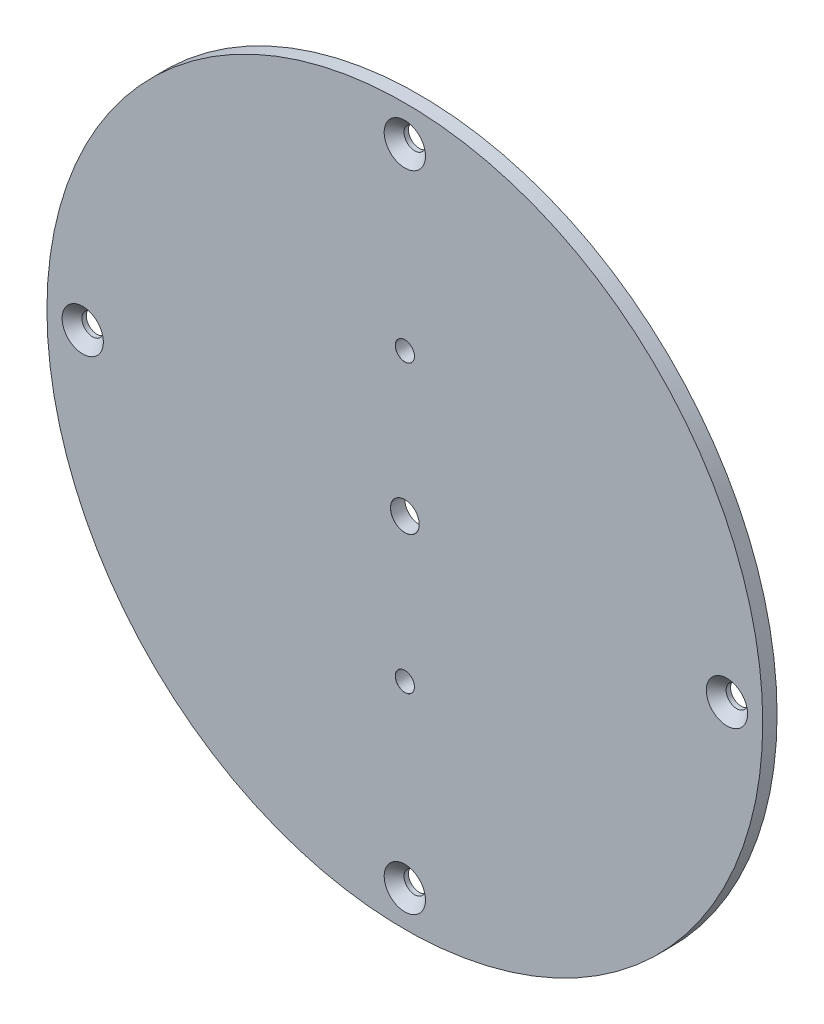
from build123d import *

# Parameters (mm, degrees)
SZKIC1_R                                    = 150
DODANIE_WYCI_GNI_CIE1_DEPTH                 = 6
OTWORY_USTALAJ_CE_8_0MM1_D                  = 8
OTWORY_USTALAJ_CE_8_0MM1_CSINK_D            = 8.05
OTWORY_USTALAJ_CE_8_0MM1_CSINK_ANGLE        = 90
POG_BIENIE_STO_KOWE_POD_M8_WKR_T_DO_2_COUNT = 2
POG_BIENIE_STO_KOWE_POD_M8_WKR_T_DO_2_PITCH = 190.91883092
POG_BIENIE_STO_KOWE_POD_M8_WKR_T_DO_3_COUNT = 2
POG_BIENIE_STO_KOWE_POD_M8_WKR_T_DO_3_PITCH = 270
POG_BIENIE_STO_KOWE_POD_M8_WKR_T_DO_4_COUNT = 2
POG_BIENIE_STO_KOWE_POD_M8_WKR_T_DO_4_PITCH = 190.91883092


with BuildPart() as part:
    # Szkic1 → Dodanie-wyciągnięcie1 (new body)
    with BuildSketch(Plane.XY):
        Circle(SZKIC1_R)
    extrude(amount=DODANIE_WYCI_GNI_CIE1_DEPTH)

    # Otwory ustalające Ø8.0mm1 (through all)
    with Locations(Plane.XY.offset(6)):
        with Locations((0, 60), (0, -60)):
            CounterSinkHole(OTWORY_USTALAJ_CE_8_0MM1_D / 2, OTWORY_USTALAJ_CE_8_0MM1_CSINK_D / 2, counter_sink_angle=OTWORY_USTALAJ_CE_8_0MM1_CSINK_ANGLE)

    # Szkic6 → Otwory ustalające Ø12.0mm1 (revolve, cut)
    with BuildSketch(Plane(origin=(0, 0, 6), x_dir=(0, -1, 0), z_dir=(1, 0, 0))):
        Polygon((0, 0), (0, 6), (6, 6), (6, 0.025), (6.025, 0), align=None)
    revolve(axis=Axis((0, 0, 12.35), (0, 0, -1)), mode=Mode.SUBTRACT)

    # Szkic10 → Pogłębienie stożkowe pod M8 wkręt do części metalowych z łbem soczewkowym1 (revolve, cut)
    with BuildSketch(Plane(origin=(0, 135, 6), x_dir=(0, -1, 0), z_dir=(1, 0, 0))):
        Polygon((0, 0), (0, 6), (4.5, 6), (4.5, 4.15), (8.65, 0), align=None)
    pog_bienie_sto_kowe_pod_m8_wkr_t_do_cz_c = revolve(axis=Axis((0, 135, 12.35), (0, 0, -1)), mode=Mode.SUBTRACT)

    # Pog_bienie sto_kowe pod M8 wkr_t do  2: Pogłębienie stożkowe pod M8 wkręt do części metalowych z łbem soczewkowym1 ×2
    with Locations(*[Vector(0.7071067811865674, -0.7071067811865276, 0) * (i * POG_BIENIE_STO_KOWE_POD_M8_WKR_T_DO_2_PITCH) for i in range(1, POG_BIENIE_STO_KOWE_POD_M8_WKR_T_DO_2_COUNT)]):
        add(pog_bienie_sto_kowe_pod_m8_wkr_t_do_cz_c, mode=Mode.SUBTRACT)

    # Pog_bienie sto_kowe pod M8 wkr_t do  3: Pogłębienie stożkowe pod M8 wkręt do części metalowych z łbem soczewkowym1 ×2
    with Locations(*[(0, -i * POG_BIENIE_STO_KOWE_POD_M8_WKR_T_DO_3_PITCH, 0) for i in range(1, POG_BIENIE_STO_KOWE_POD_M8_WKR_T_DO_3_COUNT)]):
        add(pog_bienie_sto_kowe_pod_m8_wkr_t_do_cz_c, mode=Mode.SUBTRACT)

    # Pog_bienie sto_kowe pod M8 wkr_t do  4: Pogłębienie stożkowe pod M8 wkręt do części metalowych z łbem soczewkowym1 ×2
    with Locations(*[Vector(-0.7071067811865277, -0.7071067811865674, 0) * (i * POG_BIENIE_STO_KOWE_POD_M8_WKR_T_DO_4_PITCH) for i in range(1, POG_BIENIE_STO_KOWE_POD_M8_WKR_T_DO_4_COUNT)]):
        add(pog_bienie_sto_kowe_pod_m8_wkr_t_do_cz_c, mode=Mode.SUBTRACT)


solid = part.part
